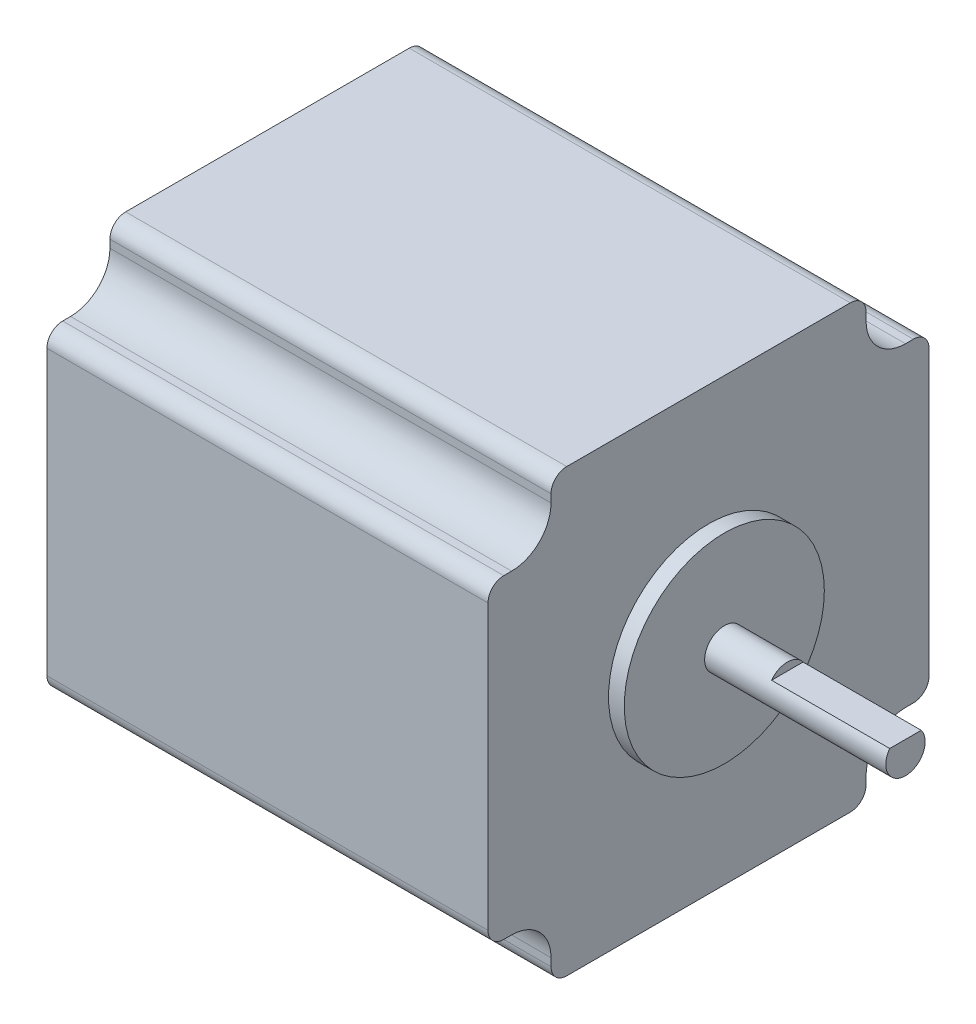
from build123d import *

# Parameters (mm, degrees)
BOSS_EXTRUDE1_DEPTH = 10
BOSS_EXTRUDE2_START = 36
BOSS_EXTRUDE2_DEPTH = 36
BOSS_EXTRUDE3_START = 10
BOSS_EXTRUDE3_DEPTH = 10
SKETCH4_R           = 2.5
BOSS_EXTRUDE4_DEPTH = 25
SKETCH4_3_R         = 12.7
BOSS_EXTRUDE5_DEPTH = 2
CUT_EXTRUDE1_START  = -15
CUT_EXTRUDE1_DEPTH  = 15


with BuildPart() as part:
    # Sketch1 → Boss-Extrude1 (new body)
    with BuildSketch(Plane(origin=(0, 0, 0), x_dir=(0, 0, -1), z_dir=(1, 0, 0))):
        with BuildLine():
            Line((-20, 26), (-20, 25))
            ThreePointArc((-20, 25), (-21.464466094, 21.464466094), (-25, 20))
            Line((-25, 20), (-26, 20))
            ThreePointArc((-26, 20), (-27.414213562, 19.414213562), (-28, 18))
            Line((-28, 18), (-28, -18))
            ThreePointArc((-28, -18), (-27.414213562, -19.414213562), (-26, -20))
            Line((-26, -20), (-25, -20))
            ThreePointArc((-25, -20), (-21.464466094, -21.464466094), (-20, -25))
            Line((-20, -25), (-20, -26))
            ThreePointArc((-20, -26), (-19.414213562, -27.414213562), (-18, -28))
            Line((-18, -28), (18, -28))
            ThreePointArc((18, -28), (19.414213562, -27.414213562), (20, -26))
            Line((20, -26), (20, -25))
            ThreePointArc((20, -25), (21.464466094, -21.464466094), (25, -20))
            Line((25, -20), (26, -20))
            ThreePointArc((26, -20), (27.414213562, -19.414213562), (28, -18))
            Line((28, -18), (28, 18))
            ThreePointArc((28, 18), (27.414213562, 19.414213562), (26, 20))
            Line((26, 20), (25, 20))
            ThreePointArc((25, 20), (21.464466094, 21.464466094), (20, 25))
            Line((20, 25), (20, 26))
            ThreePointArc((20, 26), (19.414213562, 27.414213562), (18, 28))
            Line((18, 28), (-18, 28))
            ThreePointArc((-18, 28), (-19.414213562, 27.414213562), (-20, 26))
        make_face()
    extrude(amount=-BOSS_EXTRUDE1_DEPTH)

    # Sketch2 → Boss-Extrude2 (add)
    with BuildSketch(Plane(origin=(0, 0, 0), x_dir=(0, 0, -1), z_dir=(1, 0, 0)).offset(BOSS_EXTRUDE2_START)):
        with BuildLine():
            Line((20, -26), (20, -25))
            ThreePointArc((20, -25), (21.464466094, -21.464466094), (25, -20))
            Line((25, -20), (26, -20))
            ThreePointArc((26, -20), (27.414213562, -19.414213562), (28, -18))
            Line((28, -18), (28, 18))
            ThreePointArc((28, 18), (27.414213562, 19.414213562), (26, 20))
            Line((26, 20), (25, 20))
            ThreePointArc((25, 20), (21.464466094, 21.464466094), (20, 25))
            Line((20, 25), (20, 26))
            ThreePointArc((20, 26), (19.414213562, 27.414213562), (18, 28))
            Line((18, 28), (-18, 28))
            ThreePointArc((-18, 28), (-19.414213562, 27.414213562), (-20, 26))
            Line((-20, 26), (-20, 25))
            ThreePointArc((-20, 25), (-21.464466094, 21.464466094), (-25, 20))
            Line((-25, 20), (-26, 20))
            ThreePointArc((-26, 20), (-27.414213562, 19.414213562), (-28, 18))
            Line((-28, 18), (-28, -18))
            ThreePointArc((-28, -18), (-27.414213562, -19.414213562), (-26, -20))
            Line((-26, -20), (-25, -20))
            ThreePointArc((-25, -20), (-21.464466094, -21.464466094), (-20, -25))
            Line((-20, -25), (-20, -26))
            ThreePointArc((-20, -26), (-19.414213562, -27.414213562), (-18, -28))
            Line((-18, -28), (18, -28))
            ThreePointArc((18, -28), (19.414213562, -27.414213562), (20, -26))
        make_face()
    extrude(amount=-BOSS_EXTRUDE2_DEPTH)

    # Sketch3 → Boss-Extrude3 (add)
    with BuildSketch(Plane(origin=(36, 0, 0), x_dir=(0, 0, -1), z_dir=(1, 0, 0)).offset(BOSS_EXTRUDE3_START)):
        with BuildLine():
            Line((-26, -20), (-25, -20))
            ThreePointArc((-25, -20), (-21.464466094, -21.464466094), (-20, -25))
            Line((-20, -25), (-20, -26))
            ThreePointArc((-20, -26), (-19.414213562, -27.414213562), (-18, -28))
            Line((-18, -28), (18, -28))
            ThreePointArc((18, -28), (19.414213562, -27.414213562), (20, -26))
            Line((20, -26), (20, -25))
            ThreePointArc((20, -25), (21.464466094, -21.464466094), (25, -20))
            Line((25, -20), (26, -20))
            ThreePointArc((26, -20), (27.414213562, -19.414213562), (28, -18))
            Line((28, -18), (28, 18))
            ThreePointArc((28, 18), (27.414213562, 19.414213562), (26, 20))
            Line((26, 20), (25, 20))
            ThreePointArc((25, 20), (21.464466094, 21.464466094), (20, 25))
            Line((20, 25), (20, 26))
            ThreePointArc((20, 26), (19.414213562, 27.414213562), (18, 28))
            Line((18, 28), (-18, 28))
            ThreePointArc((-18, 28), (-19.414213562, 27.414213562), (-20, 26))
            Line((-20, 26), (-20, 25))
            ThreePointArc((-20, 25), (-21.464466094, 21.464466094), (-25, 20))
            Line((-25, 20), (-26, 20))
            ThreePointArc((-26, 20), (-27.414213562, 19.414213562), (-28, 18))
            Line((-28, 18), (-28, -18))
            ThreePointArc((-28, -18), (-27.414213562, -19.414213562), (-26, -20))
        make_face()
    extrude(amount=-BOSS_EXTRUDE3_DEPTH)

    # Sketch4 → Boss-Extrude4 (add)
    with BuildSketch(Plane(origin=(46, 0, 0), x_dir=(0, 0, -1), z_dir=(1, 0, 0))):
        Circle(SKETCH4_R)
    extrude(amount=BOSS_EXTRUDE4_DEPTH)

    # Sketch4<3> → Boss-Extrude5 (add)
    with BuildSketch(Plane(origin=(46, 0, 0), x_dir=(0, 0, -1), z_dir=(1, 0, 0))):
        Circle(SKETCH4_3_R)
    extrude(amount=BOSS_EXTRUDE5_DEPTH)

    # Sketch5 → Cut-Extrude1 (cut)
    with BuildSketch(Plane(origin=(71, 0, 0), x_dir=(0, 0, -1), z_dir=(1, 0, 0)).offset(CUT_EXTRUDE1_START)):
        with BuildLine():
            Line((-2, 1.5), (2, 1.5))
            ThreePointArc((2, 1.5), (0, 2.5), (-2, 1.5))
        make_face()
    extrude(amount=CUT_EXTRUDE1_DEPTH, mode=Mode.SUBTRACT)


solid = part.part
